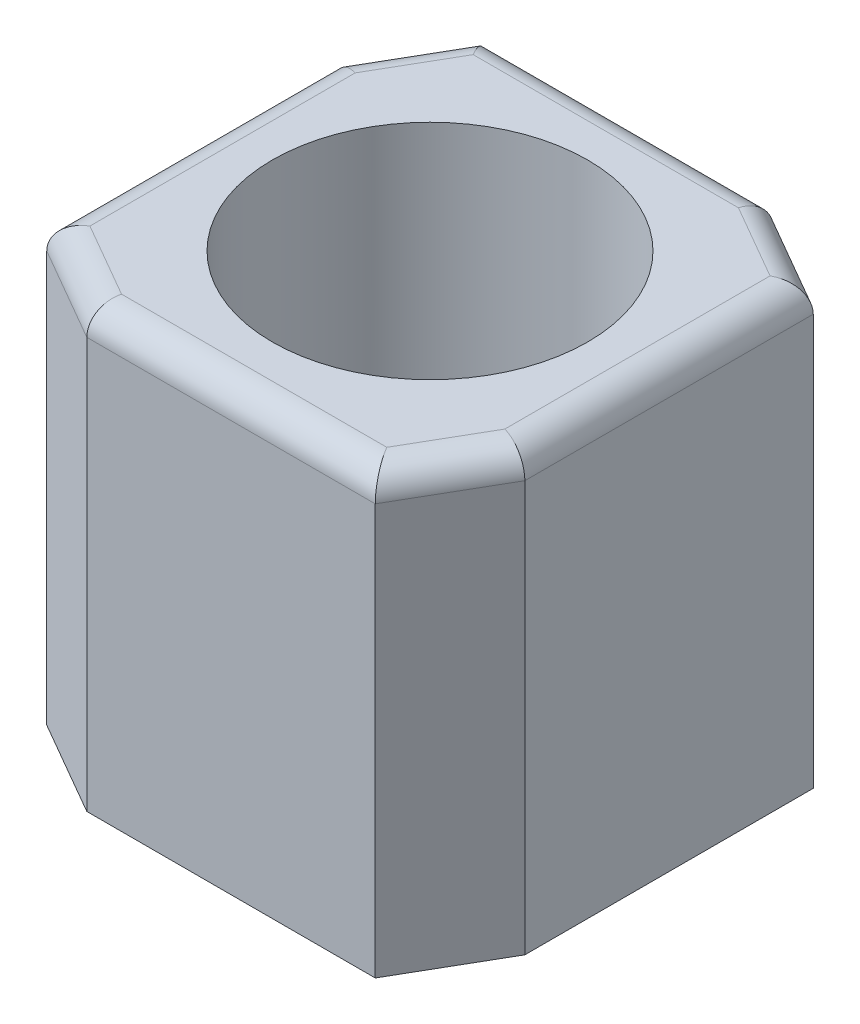
from build123d import *
from OCP.BRepFilletAPI import BRepFilletAPI_MakeChamfer

# Parameters (mm, degrees)
SKETCH1_W           = 6.35
SKETCH1_H           = 6.35
SKETCH1_R           = 2.286
BOSS_EXTRUDE1_DEPTH = 6.35
CHAMFER1_SIZE       = 0.79375
CHAMFER1_SIZE2      = 1.374815329
FILLET1_R           = 0.396875
FILLET2_R           = 0.396875


with BuildPart() as part:
    # Sketch1 → Boss-Extrude1 (new body)
    with BuildSketch(Plane(origin=(0, 0, 0), x_dir=(1, 0, 0), z_dir=(0, 1, 0))):
        Rectangle(SKETCH1_W, SKETCH1_H)
        with Locations(Location((0, 0, 0), (0, 0, 270))):
            Circle(SKETCH1_R, mode=Mode.SUBTRACT)
    extrude(amount=BOSS_EXTRUDE1_DEPTH)

    # Chamfer1: one chamfer whose edges measure the first distance from different faces: ONE call of the kernel's chamfer builder (chamfer() names one face for all edges)
    chamfer1_edges_1 = [part.edges().sort_by_distance(p)[0] for p in [
        (3.175, 3.175, 3.175),
    ]]
    chamfer1_side_1 = [part.faces().sort_by_distance(p)[0] for p in [
        (0, 3.175, 3.175),
    ]]
    chamfer1_edges_2 = [part.edges().sort_by_distance(p)[0] for p in [
        (-3.175, 3.175, 3.175),
    ]]
    chamfer1_side_2 = [part.faces().sort_by_distance(p)[0] for p in [
        (-3.175, 3.175, 0),
    ]]
    chamfer1_edges_3 = [part.edges().sort_by_distance(p)[0] for p in [
        (-3.175, 3.175, -3.175),
    ]]
    chamfer1_side_3 = [part.faces().sort_by_distance(p)[0] for p in [
        (0, 3.175, -3.175),
    ]]
    chamfer1_edges_4 = [part.edges().sort_by_distance(p)[0] for p in [
        (3.175, 3.175, -3.175),
    ]]
    chamfer1_side_4 = [part.faces().sort_by_distance(p)[0] for p in [
        (3.175, 3.175, 0),
    ]]
    chamfer1 = BRepFilletAPI_MakeChamfer(part.part.solid().wrapped)
    for e in chamfer1_edges_1:
        chamfer1.Add(CHAMFER1_SIZE, CHAMFER1_SIZE2, e.wrapped, chamfer1_side_1[0].wrapped)  # the first distance lies on this face
    for e in chamfer1_edges_2:
        chamfer1.Add(CHAMFER1_SIZE, CHAMFER1_SIZE2, e.wrapped, chamfer1_side_2[0].wrapped)  # the first distance lies on this face
    for e in chamfer1_edges_3:
        chamfer1.Add(CHAMFER1_SIZE, CHAMFER1_SIZE2, e.wrapped, chamfer1_side_3[0].wrapped)  # the first distance lies on this face
    for e in chamfer1_edges_4:
        chamfer1.Add(CHAMFER1_SIZE, CHAMFER1_SIZE2, e.wrapped, chamfer1_side_4[0].wrapped)  # the first distance lies on this face
    add(Compound.cast(chamfer1.Shape()), mode=Mode.REPLACE)

    # Fillet1
    fillet1_edges = [part.edges().sort_by_distance(p)[0] for p in [
        (-3.175, 6.35, 0.290532664),
        (-0.290532664, 6.35, -3.175),
        (3.175, 6.35, -0.290532664),
        (0.290532664, 6.35, 3.175),
        (-2.487592336, 6.35, 2.778125),
        (2.778125, 6.35, 2.487592336),
        (2.487592336, 6.35, -2.778125),
        (-2.778125, 6.35, -2.487592336),
    ]]
    fillet(fillet1_edges, radius=FILLET1_R)

    # Fillet2
    fillet2_edges = [part.edges().sort_by_distance(p)[0] for p in [
        (0, 0, -2.286),
    ]]
    fillet(fillet2_edges, radius=FILLET2_R)


solid = part.part
